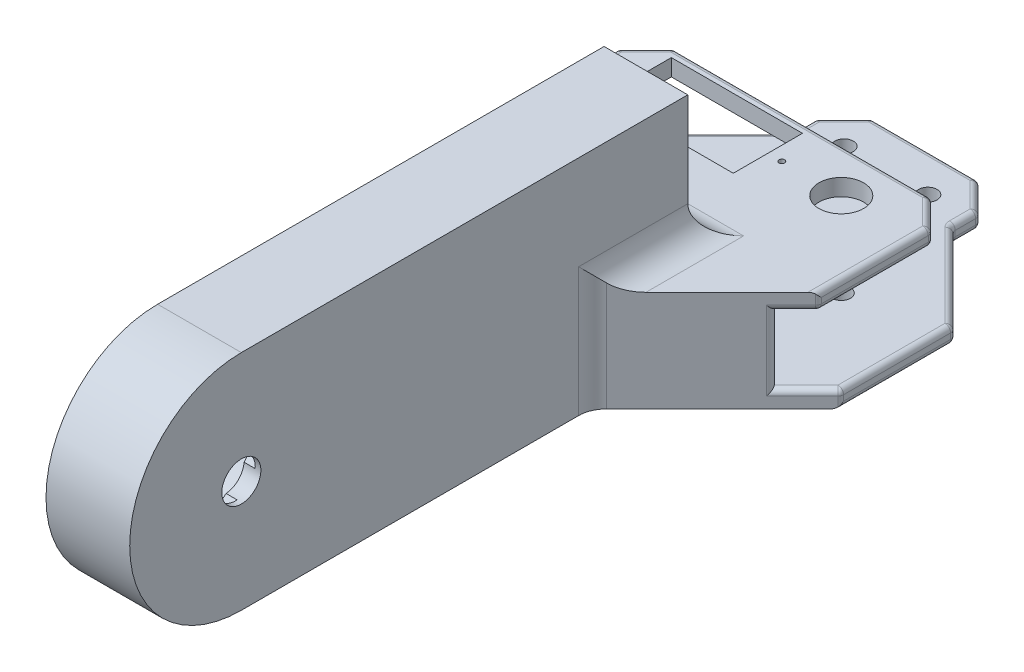
from build123d import *

# Parameters (mm, degrees)
BOSS_EXTRUDE1_DEPTH = 15
SKETCH5_R           = 17
CUT_EXTRUDE3_DEPTH  = 12
SKETCH8_R           = 3.5
CUT_EXTRUDE5_DEPTH  = 3
CUT_EXTRUDE8_DEPTH  = 2
BOSS_EXTRUDE2_DEPTH = 3
BOSS_EXTRUDE3_DEPTH = 3
SKETCH14_R          = 2
SKETCH14_R_2        = 1.65
CUT_EXTRUDE10_DEPTH = 3
SKETCH15_R          = 0.5
SKETCH15_R_2        = 4
SKETCH15_W          = 23.5
SKETCH15_H          = 12.4
CUT_EXTRUDE11_DEPTH = 3
BOSS_EXTRUDE4_DEPTH = 18.1
FILLET2_R           = 5
FILLET3_R           = 1


with BuildPart() as part:
    # Sketch1 → Boss-Extrude1 (new body)
    with BuildSketch(Plane(origin=(0, 0, 0), x_dir=(0, 0, -1), z_dir=(1, 0, 0))):
        with BuildLine():
            Line((0, 20), (80, 20))
            Line((80, 20), (80, -20))
            Line((80, -20), (0, -20))
            ThreePointArc((0, -20), (-20, 0), (0, 20))
        make_face()
    extrude(amount=BOSS_EXTRUDE1_DEPTH)

    # Sketch5 → Cut-Extrude3 (cut)
    with BuildSketch(Plane.ZY):
        Circle(SKETCH5_R)
    extrude(amount=-CUT_EXTRUDE3_DEPTH, mode=Mode.SUBTRACT)

    # Sketch8 → Cut-Extrude5 (cut)
    with BuildSketch(Plane.ZY.offset(-12)):
        Circle(SKETCH8_R)
    extrude(amount=-CUT_EXTRUDE5_DEPTH, mode=Mode.SUBTRACT)

    # Sketch10 → Cut-Extrude8 (cut)
    with BuildSketch(Plane.ZY.offset(-12)):
        with BuildLine():
            Line((-11.740635761, 8.915001197), (-3.490542592, -0.257123349))
            ThreePointArc((-3.490542592, -0.257123349), (-2.474873734, 2.474873734), (0.257123349, 3.490542592))
            Line((0.257123349, 3.490542592), (-8.915001197, 11.740635761))
            ThreePointArc((-8.915001197, 11.740635761), (-11.667842746, 11.667842746), (-11.740635761, 8.915001197))
        make_face()
        with BuildLine():
            Line((11.740635761, -8.915001197), (3.490542592, 0.257123349))
            ThreePointArc((3.490542592, 0.257123349), (3.497634849, 0.12864861), (3.5, 0))
            ThreePointArc((3.5, 0), (2.382233015, -2.564169624), (-0.257123349, -3.490542592))
            Line((-0.257123349, -3.490542592), (8.915001197, -11.740635761))
            ThreePointArc((8.915001197, -11.740635761), (11.667842746, -11.667842746), (11.740635761, -8.915001197))
        make_face()
    extrude(amount=-CUT_EXTRUDE8_DEPTH, mode=Mode.SUBTRACT)

    # Sketch13 → Boss-Extrude3 (add)
    with BuildSketch(Plane(origin=(0, -4.9, 0), x_dir=(1, 0, 0), z_dir=(0, 1, 0))):
        Polygon((-17.5, 80), (32.5, 80), (35.5, 83), (35.5, 103), (30.5, 108), (-15.5, 108), (-20.5, 103), (-20.5, 83), align=None)
    extrude(amount=BOSS_EXTRUDE3_DEPTH)

    # Sketch15 → Cut-Extrude11 (cut)
    with BuildSketch(Plane(origin=(0, -1.9, 0), x_dir=(1, 0, 0), z_dir=(0, 1, 0))):
        with Locations(Location((-16.65, 100, 0), (0, 0, 270))):
            Circle(SKETCH15_R)
        with Locations(Location((11.85, 100, 0), (0, 0, 270))):
            Circle(SKETCH15_R)
        with Locations(Location((22.5, 100, 0), (0, 0, 270))):
            Circle(SKETCH15_R_2)
        with Locations((-2.4, 100)):
            Rectangle(SKETCH15_W, SKETCH15_H)
    extrude(amount=-CUT_EXTRUDE11_DEPTH, mode=Mode.SUBTRACT)



with BuildPart() as body_2:
    # Sketch12 → Boss-Extrude2 (new body)
    with BuildSketch(Plane.XZ.offset(20)):
        Polygon((-17.5, -80), (32.5, -80), (37.5, -85), (37.5, -105), (22, -120.5), (22, -125), (17, -130), (-2, -130), (-7, -125), (-7, -120.5), (-22.5, -105), (-22.5, -85), align=None)
    extrude(amount=-BOSS_EXTRUDE2_DEPTH)

    # Sketch14 → Cut-Extrude10 (cut)
    with BuildSketch(Plane.XZ.offset(20)):
        with Locations(Location((-7.5, -100, 0), (0, 0, 270))):
            Circle(SKETCH14_R)
        with Locations(Location((22.5, -100, 0), (0, 0, 270))):
            Circle(SKETCH14_R_2)
        with Locations(Location((15, -123, 0), (0, 0, 270))):
            Circle(SKETCH14_R_2)
        with Locations(Location((0, -123, 0), (0, 0, 270))):
            Circle(SKETCH14_R_2)
    extrude(amount=-CUT_EXTRUDE10_DEPTH, mode=Mode.SUBTRACT)


with BuildPart() as part_1:
    add(part.part)

    add(body_2.part)  # Boss-Extrude4 merges body 2
    # Sketch16 → Boss-Extrude4 (add)
    with BuildSketch(Plane(origin=(0, -1.9, 0), x_dir=(1, 0, 0), z_dir=(0, 1, 0))):
        Polygon((-17.5, 80), (0, 80), (0, 62.5), align=None)
        Polygon((15, 80), (32.5, 80), (15, 62.5), align=None)
    extrude(amount=-BOSS_EXTRUDE4_DEPTH)

    # Fillet2
    fillet2_edges = [part_1.edges().sort_by_distance(p)[0] for p in [
        (15, -10.95, -62.5),
        (15, -1.9, -71.25),
        (0, -1.9, -71.25),
        (7.5, -1.9, -80),
    ]]
    fillet(fillet2_edges, radius=FILLET2_R)

    # Fillet3
    fillet3_edges = [part_1.edges().sort_by_distance(p)[0] for p in [
        (-7, -20, -122.75),
        (32.5, -10.95, -80),
        (-4.5, -20, -127.5),
        (-20, -17, -82.5),
        (7.5, -20, -130),
        (19.5, -20, -127.5),
        (22, -20, -122.75),
        (29.75, -20, -112.75),
        (37.5, -20, -95),
        (-22.5, -20, -95),
        (-14.75, -20, -112.75),
        (-7, -18.5, -120.5),
        (-7, -18.5, -125),
        (-2, -18.5, -130),
        (35, -17, -82.5),
        (17, -18.5, -130),
        (22, -18.5, -125),
        (22, -18.5, -120.5),
        (37.5, -18.5, -105),
        (37.5, -18.5, -85),
        (-22.5, -18.5, -85),
        (-22.5, -18.5, -105),
        (37.5, -17, -95),
        (29.75, -17, -112.75),
        (22, -17, -122.75),
        (19.5, -17, -127.5),
        (7.5, -17, -130),
        (-4.5, -17, -127.5),
        (-7, -17, -122.75),
        (-14.75, -17, -112.75),
        (-17.5, -10.95, -80),
        (-19, -4.9, -81.5),
        (-20.5, -3.4, -83),
        (34, -4.9, -81.5),
        (35.5, -4.9, -93),
        (35.5, -3.4, -83),
        (33, -4.9, -105.5),
        (35.5, -3.4, -103),
        (7.5, -4.9, -108),
        (30.5, -3.4, -108),
        (-18, -4.9, -105.5),
        (-15.5, -3.4, -108),
        (-20.5, -4.9, -93),
        (-20.5, -3.4, -103),
        (35.5, -1.9, -93),
        (33, -1.9, -105.5),
        (7.5, -1.9, -108),
        (-18, -1.9, -105.5),
        (-20.5, -1.9, -93),
        (-22.5, -17, -95),
    ]]
    fillet(fillet3_edges, radius=FILLET3_R)


solid = part_1.part
